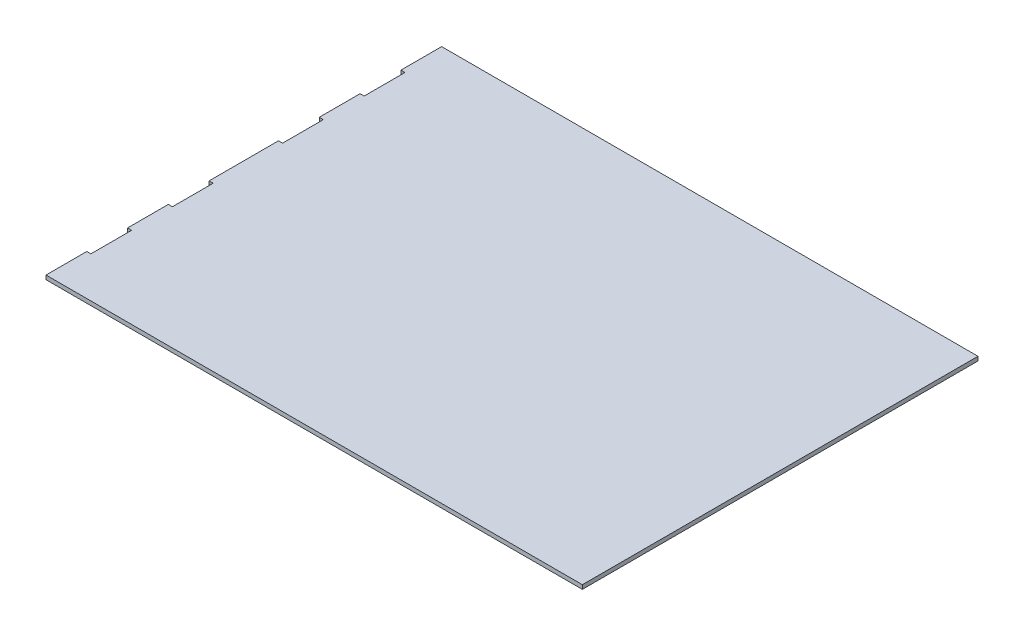
from build123d import *

# Parameters (mm, degrees)
BOSS_EXTRUDE1_DEPTH = 2
SKETCH4_W           = 2
SKETCH4_H           = 20
CUT_EXTRUDE2_DEPTH  = 10


with BuildPart() as part:
    # Sketch1 → Boss-Extrude1 (new body)
    with BuildSketch(Plane(origin=(0, 0, 0), x_dir=(1, 0, 0), z_dir=(0, 1, 0))):
        Polygon((131.5, -97), (131.5, -77), (131.5, -57), (131.5, -37), (131.5, -17), (131.5, 17), (131.5, 37), (131.5, 57), (131.5, 77), (131.5, 97), (113.5, 97), (103.5, 97), (83.5, 97), (73.5, 97), (53.5, 97), (-23.5, 97), (-43.5, 97), (-53.5, 97), (-73.5, 97), (-83.5, 97), (-103.5, 97), (-113.5, 97), (-131.5, 97), (-131.5, -97), (-113.5, -97), (-103.5, -97), (-83.5, -97), (-73.5, -97), (-53.5, -97), (-43.5, -97), (-23.5, -97), (53.5, -97), (73.5, -97), (83.5, -97), (103.5, -97), (113.5, -97), align=None)
    extrude(amount=BOSS_EXTRUDE1_DEPTH)

    # Sketch4 → Cut-Extrude2 (cut)
    with BuildSketch(Plane(origin=(0, 2, 0), x_dir=(1, 0, 0), z_dir=(0, 1, 0))):
        with Locations((-130.5, 67)):
            Rectangle(SKETCH4_W, SKETCH4_H)
        with Locations((-130.5, 27)):
            Rectangle(SKETCH4_W, SKETCH4_H)
        with Locations((-130.5, -27)):
            Rectangle(SKETCH4_W, SKETCH4_H)
        with Locations((-130.5, -67)):
            Rectangle(SKETCH4_W, SKETCH4_H)
    extrude(amount=-CUT_EXTRUDE2_DEPTH, mode=Mode.SUBTRACT)


solid = part.part
